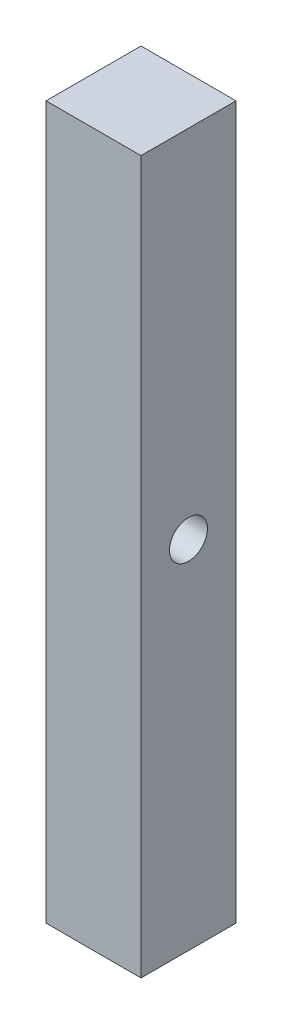
from build123d import *

# Parameters (mm, degrees)
SKETCH1_W               = 20
SKETCH1_H               = 20
BOSS_EXTRUDE1_DEPTH     = 150
CUT_EXTRUDE1_DEPTH      = 152.657508881
CUT_EXTRUDE1_DEPTH_BACK = 152.657508881
SKETCH2_R               = 4


with BuildPart() as part:
    # Sketch1 → Boss-Extrude1 (new body)
    with BuildSketch(Plane(origin=(0, 0, 0), x_dir=(1, 0, 0), z_dir=(0, 1, 0))):
        Rectangle(SKETCH1_W, SKETCH1_H)
    extrude(amount=BOSS_EXTRUDE1_DEPTH)

    # Sketch2 → Cut-Extrude1 (cut, two sides: drawn at the far end of the back side and taken through both)
    with BuildSketch(Plane(origin=(10, 0, 0), x_dir=(0, 0, -1), z_dir=(1, 0, 0)).offset(-CUT_EXTRUDE1_DEPTH_BACK)):
        with Locations((0, 75)):
            Circle(SKETCH2_R)
    extrude(amount=CUT_EXTRUDE1_DEPTH + CUT_EXTRUDE1_DEPTH_BACK, mode=Mode.SUBTRACT)


solid = part.part
